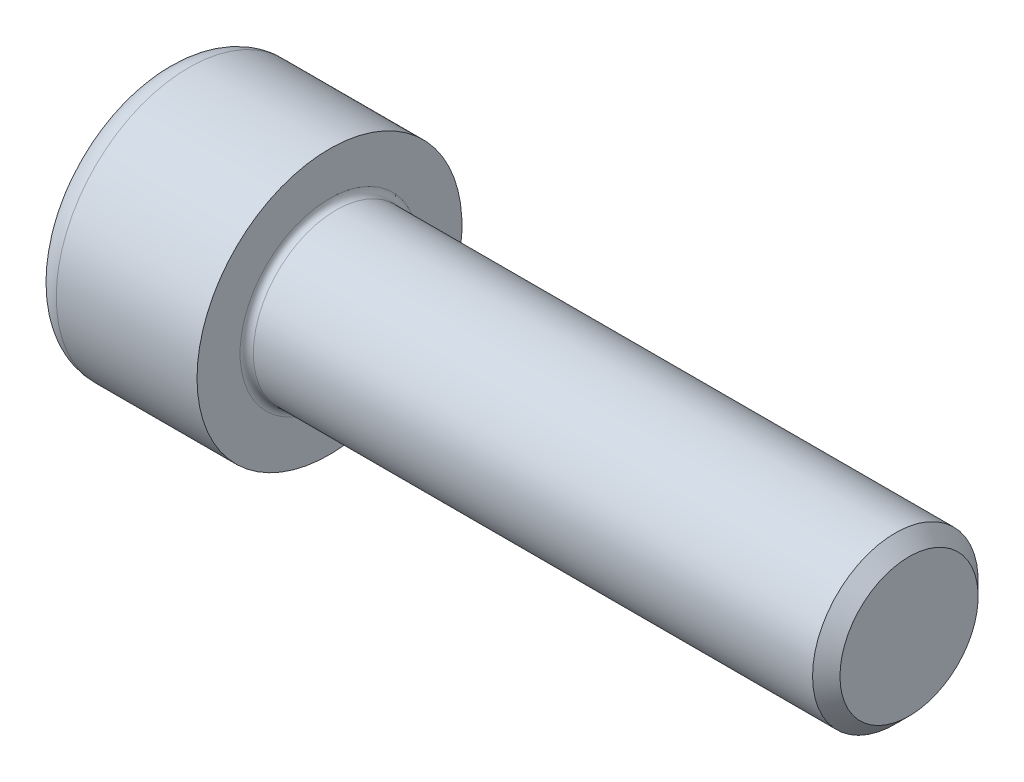
from build123d import *

# Parameters (mm, degrees)
FILLET1_R   = 0.4
FILLET2_R   = 1.5
HEX_2_DEPTH = 5


with BuildPart() as part:
    # BodySke → Base-Revolve (revolve)
    with BuildSketch(Plane.XY, mode=Mode.PRIVATE) as base_revolve_sk:
        Polygon((0, 0), (0, 8), (10, 8), (10, 5), (44.172, 5), (45, 4.172), (45, 0), align=None)
    revolve(base_revolve_sk.sketch.rotate(Axis((-31.75, 0, 0), (1, 0, 0)), 90), axis=Axis((-31.75, 0, 0), (1, 0, 0)))

    # Fillet1
    fillet1_edges = [part.edges().sort_by_distance(p)[0] for p in [
        (10, 0, -5),
    ]]
    fillet(fillet1_edges, radius=FILLET1_R)

    # Fillet2
    fillet2_edges = [part.edges().sort_by_distance(p)[0] for p in [
        (0, 0, -8),
    ]]
    fillet(fillet2_edges, radius=FILLET2_R)

    # Sketch2 → Hex-PreBroach (revolve, cut)
    with BuildSketch(Plane.XY, mode=Mode.PRIVATE) as hex_prebroach_sk:
        Polygon((0, 4.0575), (5, 4.0575), (7.342598717, 0), (0, 0), align=None)
    revolve(hex_prebroach_sk.sketch.rotate(Axis((0, 0, 0), (1, 0, 0)), 90), axis=Axis((0, 0, 0), (1, 0, 0)), mode=Mode.SUBTRACT)

    # Sketch3 → Hex 2 (cut)
    with BuildSketch(Plane(origin=(0, 0, 0), x_dir=(0, 0.500000000000001, 0.866025403784438), z_dir=(-1, 0, 0))):
        Polygon((2.342598717, 4.0575), (-2.342598717, 4.0575), (-4.685197434, 0), (-2.342598717, -4.0575), (2.342598717, -4.0575), (4.685197434, 0), align=None)
    extrude(amount=-HEX_2_DEPTH, mode=Mode.SUBTRACT)


solid = part.part
